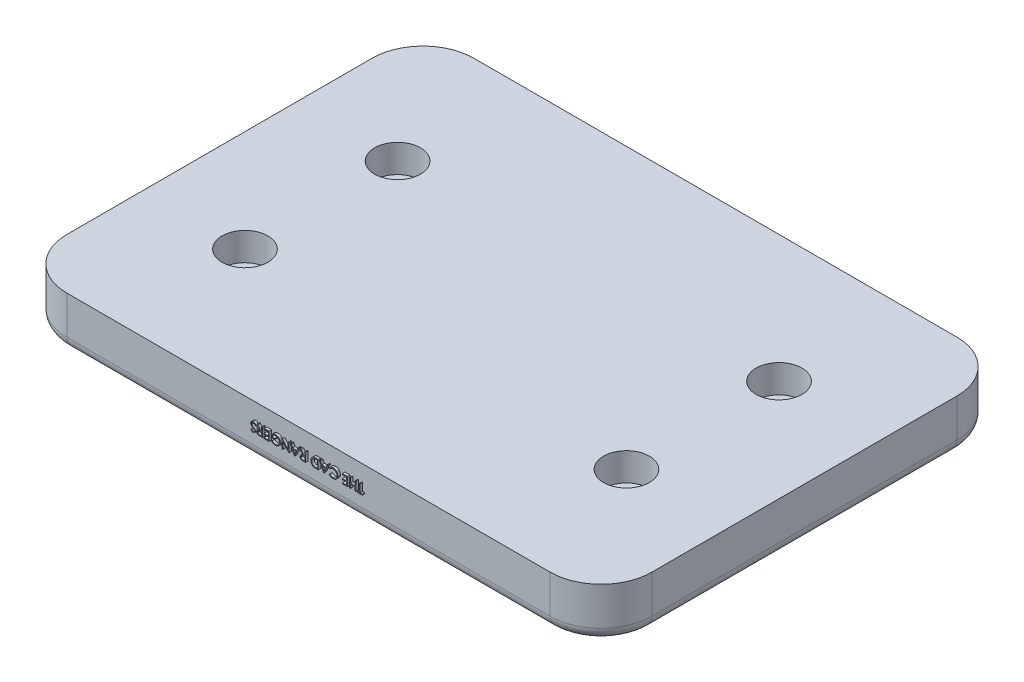
from build123d import *

# Parameters (mm, degrees)
BOSS_EXTRUDE1_DEPTH = 20
SKETCH2_R           = 5.5
CUT_EXTRUDE1_DEPTH  = 20
FILLET1_R           = 5
SKETCH3_R           = 9
CUT_EXTRUDE2_DEPTH  = 11
BOSS_EXTRUDE2_DEPTH = 1


with BuildPart() as part:
    # Sketch1 → Boss-Extrude1 (new body)
    with BuildSketch(Plane(origin=(0, 0, 0), x_dir=(1, 0, 0), z_dir=(0, 1, 0))):
        with BuildLine():
            Line((-95, -80), (95, -80))
            ThreePointArc((95, -80), (109.142135624, -74.142135624), (115, -60))
            Line((115, -60), (115, 60))
            ThreePointArc((115, 60), (109.142135624, 74.142135624), (95, 80))
            Line((95, 80), (-95, 80))
            ThreePointArc((-95, 80), (-109.142135624, 74.142135624), (-115, 60))
            Line((-115, 60), (-115, -60))
            ThreePointArc((-115, -60), (-109.142135624, -74.142135624), (-95, -80))
        make_face()
    extrude(amount=BOSS_EXTRUDE1_DEPTH)

    # Sketch2 → Cut-Extrude1 (cut)
    with BuildSketch(Plane.XZ):
        with Locations(Location((-75, 30, 0), (0, 0, 270))):
            Circle(SKETCH2_R)
        with Locations(Location((75, 30, 0), (0, 0, 90))):
            Circle(SKETCH2_R)
        with Locations(Location((75, -30, 0), (0, 0, 270))):
            Circle(SKETCH2_R)
        with Locations(Location((-75, -30, 0), (0, 0, 90))):
            Circle(SKETCH2_R)
    extrude(amount=-CUT_EXTRUDE1_DEPTH, mode=Mode.SUBTRACT)

    # Fillet1
    fillet1_edges = [part.edges().sort_by_distance(p)[0] for p in [
        (-115, 0, 0),
        (-109.142135624, 0, -74.142135624),
        (0, 0, -80),
        (109.142135624, 0, -74.142135624),
        (115, 0, 0),
        (109.142135624, 0, 74.142135624),
        (0, 0, 80),
        (-109.142135624, 0, 74.142135624),
    ]]
    fillet(fillet1_edges, radius=FILLET1_R)

    # Sketch3 → Cut-Extrude2 (cut)
    with BuildSketch(Plane(origin=(0, 20, 0), x_dir=(1, 0, 0), z_dir=(0, 1, 0))):
        with Locations(Location((-75, 30, 0), (0, 0, 270))):
            Circle(SKETCH3_R)
        with Locations(Location((-75, -30, 0), (0, 0, 270))):
            Circle(SKETCH3_R)
        with Locations(Location((75, 30, 0), (0, 0, 270))):
            Circle(SKETCH3_R)
        with Locations(Location((75, -30, 0), (0, 0, 270))):
            Circle(SKETCH3_R)
    extrude(amount=-CUT_EXTRUDE2_DEPTH, mode=Mode.SUBTRACT)

    # Sketch4 → Boss-Extrude2 (add)
    # profile 1 of 13: a face of its own
    with BuildSketch(Plane.XY.offset(80)):
        Polygon((22.076923077, 10.601076919), (22.076923077, 10.24210256), (20.237179487, 10.24210256), (20.237179487, 10.601076919), (21, 10.601076919), (21, 13.74210256), (21.314102564, 13.74210256), (21.314102564, 10.601076919), align=None)
    # profile 2 of 13: a face of its own
    with BuildSketch(Plane.XY.offset(80)):
        Polygon((19.608974359, 10.24210256), (19.294871795, 10.24210256), (19.294871795, 11.677999996), (17.5, 11.677999996), (17.5, 10.24210256), (17.185897436, 10.24210256), (17.185897436, 13.74210256), (17.5, 13.74210256), (17.5, 12.036974355), (19.294871795, 12.036974355), (19.294871795, 13.74210256), (19.608974359, 13.74210256), align=None)
    # profile 3 of 13: a face of its own
    with BuildSketch(Plane.XY.offset(80)):
        Polygon((16.288461538, 10.24210256), (14.314102564, 10.24210256), (14.314102564, 10.601076919), (15.974358974, 10.601076919), (15.974358974, 11.677999996), (14.314102564, 11.677999996), (14.314102564, 12.036974355), (15.974358974, 12.036974355), (15.974358974, 13.383128201), (14.314102564, 13.383128201), (14.314102564, 13.74210256), (16.288461538, 13.74210256), align=None)
    # profile 4 of 13: a face of its own
    with BuildSketch(Plane.XY.offset(80)):
        with BuildLine():
            Line((9.108974359, 10.884330124), (9.383814103, 11.094666662))
            add(Edge.make_bspline(
                [(9.383814103, 11.094666662), (9.403420192, 11.071301002), (9.442368038, 11.0248847), (9.505024287, 10.959700614), (9.570336979, 10.898652342), (9.638215242, 10.84134764), (9.710229934, 10.790089704), (9.783637093, 10.740886522), (9.861103927, 10.697807443), (9.96768179, 10.645180959), (10.107647448, 10.591462617), (10.28323229, 10.545260206), (10.466778108, 10.516126028), (10.591970922, 10.512949195), (10.655649038, 10.511333329)],
                knots=[0, 0, 0, 0, 0.75789156, 1.505565099, 2.245254514, 2.979266606, 3.711207489, 4.440978832, 5.174393176, 5.91211879, 7.394186119, 8.890401545, 10.418332761, 12, 12, 12, 12], degree=3))
            add(Edge.make_bspline(
                [(10.655649038, 10.511333329), (10.690731911, 10.511739114), (10.760572055, 10.512546919), (10.864226822, 10.523129144), (10.966142355, 10.53817388), (11.065939666, 10.55995426), (11.163420604, 10.588310337), (11.2593274, 10.621564451), (11.352530553, 10.662945805), (11.44415164, 10.708646044), (11.531927025, 10.760278697), (11.614994182, 10.816579569), (11.69297847, 10.876992479), (11.766078215, 10.94137466), (11.833556827, 11.010477731), (11.89613116, 11.083525276), (11.953721345, 11.160847184), (12.006267963, 11.242074007), (12.053267598, 11.326804508), (12.094023918, 11.414674733), (12.128474972, 11.505348995), (12.156423841, 11.598632967), (12.178297769, 11.694196446), (12.193439185, 11.792381603), (12.203923916, 11.893016814), (12.204724602, 11.961225918), (12.205128205, 11.995608169)],
                knots=[0, 0, 0, 0, 1.054960097, 2.100129169, 3.131228542, 4.15308236, 5.169990287, 6.183953224, 7.204064171, 8.235355279, 9.262684623, 10.264978336, 11.252191258, 12.228402777, 13.192898315, 14.155264692, 15.119862721, 16.091023151, 17.063429752, 18.032246104, 19.00241354, 19.978852882, 20.959535218, 21.948948728, 22.966123959, 24, 24, 24, 24], degree=3))
            add(Edge.make_bspline(
                [(12.205128205, 11.995608169), (12.203863427, 12.047338336), (12.201380204, 12.148903656), (12.179373871, 12.297690637), (12.145664481, 12.440365495), (12.095970439, 12.575962192), (12.033472298, 12.705611091), (11.955491851, 12.827739933), (11.864835006, 12.944137942), (11.760571741, 13.051986025), (11.6461629, 13.150498357), (11.52341579, 13.237249308), (11.39263129, 13.309564093), (11.255254717, 13.369740065), (11.110228588, 13.415996786), (10.95781379, 13.448560911), (10.798341793, 13.469803091), (10.689372394, 13.471836779), (10.633914263, 13.472871791)],
                knots=[0, 0, 0, 0, 1.029159485, 2.020618137, 2.987588728, 3.942669054, 4.889339625, 5.846988364, 6.821327795, 7.821533711, 8.827683044, 9.822769455, 10.807800696, 11.797391277, 12.803701919, 13.832062008, 14.896664671, 16, 16, 16, 16], degree=3))
            add(Edge.make_bspline(
                [(10.633914263, 13.472871791), (10.572811574, 13.471183011), (10.452546865, 13.467859088), (10.276178839, 13.439699839), (10.107343073, 13.394041921), (9.946030486, 13.330143999), (9.79269584, 13.247078711), (9.64709918, 13.146380834), (9.509117609, 13.027092501), (9.426146327, 12.936009373), (9.383814103, 12.889538457)],
                knots=[0, 0, 0, 0, 1.028121516, 2.023589091, 2.998037872, 3.967518031, 4.937445131, 5.927275754, 6.942489185, 8, 8, 8, 8], degree=3))
            Line((9.383814103, 12.889538457), (9.108974359, 13.09777163))
            add(Edge.make_bspline(
                [(9.108974359, 13.09777163), (9.131093215, 13.126309143), (9.175224979, 13.183247476), (9.246671929, 13.263533111), (9.32199057, 13.338985127), (9.401384231, 13.409210573), (9.484956553, 13.474560462), (9.572671011, 13.534730929), (9.664090115, 13.590389445), (9.759328337, 13.640837351), (9.858390888, 13.685727561), (9.960428826, 13.724961502), (10.065629064, 13.757905961), (10.173162013, 13.785586127), (10.284132572, 13.805355053), (10.397271045, 13.821088092), (10.513630821, 13.830424175), (10.592064146, 13.831367906), (10.631810897, 13.83184615)],
                knots=[0, 0, 0, 0, 0.986880684, 1.969034265, 2.935876267, 3.899990983, 4.864973347, 5.834408638, 6.8063673, 7.789580233, 8.778939794, 9.778051223, 10.776304221, 11.791326552, 12.811423977, 13.855999788, 14.91350973, 16, 16, 16, 16], degree=3))
            add(Edge.make_bspline(
                [(10.631810897, 13.83184615), (10.669454564, 13.831584157), (10.743890255, 13.831066099), (10.853789006, 13.822673932), (10.960778587, 13.811224195), (11.064553213, 13.793984064), (11.165679188, 13.773639724), (11.263239772, 13.746368467), (11.358194983, 13.715819301), (11.450163323, 13.679914314), (11.539223023, 13.639398131), (11.625086835, 13.593606572), (11.707715267, 13.542924708), (11.787920688, 13.488469697), (11.864518272, 13.428492395), (11.938171797, 13.363825761), (12.009294273, 13.29468775), (12.053296958, 13.244832897), (12.075420673, 13.219766823)],
                knots=[0, 0, 0, 0, 1.114604814, 2.203992996, 3.262667896, 4.300477797, 5.318619304, 6.316056647, 7.298880507, 8.271930387, 9.238335007, 10.195173496, 11.151986948, 12.108099108, 13.064862484, 14.031167946, 15.010108607, 16, 16, 16, 16], degree=3))
            add(Edge.make_bspline(
                [(12.075420673, 13.219766823), (12.110854005, 13.176224736), (12.181292887, 13.089666239), (12.271452601, 12.949393483), (12.348371514, 12.803067255), (12.411257532, 12.649840007), (12.459561329, 12.489652173), (12.493522039, 12.322761448), (12.515436834, 12.149501456), (12.517952196, 12.031666328), (12.519230769, 11.971770028)],
                knots=[0, 0, 0, 0, 0.994611881, 1.977215934, 2.950189954, 3.921972279, 4.908960509, 5.911694611, 6.938501887, 8, 8, 8, 8], degree=3))
            add(Edge.make_bspline(
                [(12.519230769, 11.971770028), (12.51766862, 11.908817208), (12.514595188, 11.784961466), (12.488698673, 11.603149919), (12.446534143, 11.429212252), (12.388473305, 11.262479193), (12.311875535, 11.103904725), (12.21914774, 10.952819122), (12.109384194, 10.80934575), (11.983963421, 10.675318928), (11.846388838, 10.55278284), (11.699071919, 10.444975783), (11.542289472, 10.355258492), (11.377771755, 10.280262269), (11.204286037, 10.222617823), (11.022202678, 10.182264631), (10.83186376, 10.157147516), (10.702001335, 10.153972308), (10.636017628, 10.15235897)],
                knots=[0, 0, 0, 0, 1.032901378, 2.032168977, 3.007206631, 3.966850309, 4.924221947, 5.891988639, 6.871730993, 7.884084801, 8.900290346, 9.89161143, 10.874607481, 11.860025555, 12.854717796, 13.869097222, 14.917278314, 16, 16, 16, 16], degree=3))
            add(Edge.make_bspline(
                [(10.636017628, 10.15235897), (10.595803209, 10.152841168), (10.516202817, 10.153795629), (10.398449394, 10.163100913), (10.283809901, 10.178617674), (10.171965427, 10.199764442), (10.062731491, 10.226066958), (9.956598999, 10.259001182), (9.85387205, 10.298820835), (9.753857953, 10.343139123), (9.657839059, 10.393895528), (9.565863128, 10.449065458), (9.478676987, 10.509711299), (9.395713886, 10.574948552), (9.317357386, 10.645279078), (9.24243152, 10.719520712), (9.173160999, 10.79964286), (9.130409071, 10.856049361), (9.108974359, 10.884330124)],
                knots=[0, 0, 0, 0, 1.096566765, 2.170543479, 3.218870886, 4.250164525, 5.273529809, 6.281496242, 7.278154839, 8.276706968, 9.263143576, 10.238168486, 11.199979644, 12.157579042, 13.114563119, 14.070017788, 15.032356758, 16, 16, 16, 16], degree=3))
        make_face()
    # profile 5 of 13: a face of its own
    with BuildSketch(Plane.XY.offset(80)):
        Polygon((6.955128205, 10.24210256), (5.33974359, 13.74210256), (5.681189904, 13.74210256), (6.198617788, 12.620307688), (7.78525641, 12.620307688), (8.317407853, 13.74210256), (8.66025641, 13.74210256), (7, 10.24210256), align=None)
        Polygon((6.981069712, 10.924294066), (7.614883814, 12.261333329), (6.364082532, 12.261333329), align=None, mode=Mode.SUBTRACT)
    # profile 6 of 13: a face of its own
    with BuildSketch(Plane.XY.offset(80)):
        with BuildLine():
            Line((4.801282051, 13.74210256), (4.801282051, 10.24210256))
            Line((4.801282051, 10.24210256), (4.094551282, 10.24210256))
            add(Edge.make_bspline(
                [(4.094551282, 10.24210256), (4.033082166, 10.242543924), (3.914324154, 10.243396637), (3.742713418, 10.248834182), (3.584156127, 10.258356082), (3.438742322, 10.272493394), (3.306238385, 10.289462131), (3.186856536, 10.311042127), (3.080403308, 10.336421664), (3.014933995, 10.358068133), (2.983974359, 10.368304483)],
                knots=[0, 0, 0, 0, 1.314317071, 2.539253741, 3.67075822, 4.709970291, 5.662644612, 6.526156501, 7.303037452, 8, 8, 8, 8], degree=3))
            add(Edge.make_bspline(
                [(2.983974359, 10.368304483), (2.943475998, 10.383730401), (2.863397645, 10.414232427), (2.749443094, 10.471858237), (2.641803791, 10.536883824), (2.541329662, 10.6108), (2.447799317, 10.692662203), (2.36003594, 10.781808103), (2.280555107, 10.880617595), (2.206615499, 10.986024656), (2.141899159, 11.098988513), (2.084831783, 11.217246515), (2.036104908, 11.340569206), (1.998084857, 11.469856415), (1.966673725, 11.60386639), (1.945597626, 11.74361375), (1.93159762, 11.888283757), (1.930197561, 11.986459484), (1.929487179, 12.036273233)],
                knots=[0, 0, 0, 0, 0.984696416, 1.947063185, 2.89840987, 3.841051395, 4.778753227, 5.721858861, 6.681155121, 7.65838316, 8.646299769, 9.637283673, 10.641736726, 11.657050558, 12.698485921, 13.768600492, 14.86780186, 16, 16, 16, 16], degree=3))
            add(Edge.make_bspline(
                [(1.929487179, 12.036273233), (1.930116571, 12.079534325), (1.931356854, 12.164784825), (1.942480096, 12.29042782), (1.958678611, 12.412333718), (1.983642318, 12.529967244), (2.014317142, 12.64412039), (2.052177697, 12.754252657), (2.097052068, 12.860438898), (2.149093592, 12.961835706), (2.206076938, 13.058196521), (2.268169649, 13.147994567), (2.333245708, 13.232219907), (2.403678559, 13.308969797), (2.47713624, 13.38063425), (2.55611715, 13.444034227), (2.638148303, 13.502113056), (2.725694153, 13.553106985), (2.819472981, 13.598467599), (2.921934423, 13.636774911), (3.032704524, 13.669741206), (3.152517268, 13.696006493), (3.280973069, 13.717177648), (3.418420142, 13.73127655), (3.564601107, 13.740837365), (3.664980702, 13.741672639), (3.716646635, 13.74210256)],
                knots=[0, 0, 0, 0, 1.105894396, 2.179280415, 3.222964075, 4.248423888, 5.251546139, 6.243661943, 7.223682738, 8.196462441, 9.155694589, 10.083899862, 10.986397372, 11.874737962, 12.745335529, 13.607670254, 14.461432187, 15.313100333, 16.195087267, 17.121790994, 18.106827133, 19.14775296, 20.255889161, 21.433815148, 22.679170477, 24, 24, 24, 24], degree=3))
            Line((3.716646635, 13.74210256), (4.801282051, 13.74210256))
        make_face()
        with BuildLine():
            Line((4.487179487, 13.383128201), (4.085436699, 13.383128201))
            add(Edge.make_bspline(
                [(4.085436699, 13.383128201), (4.027708328, 13.382880105), (3.91667553, 13.382402924), (3.757017532, 13.378215721), (3.611138136, 13.371373784), (3.479016626, 13.361798706), (3.360727602, 13.349130091), (3.256023852, 13.335005188), (3.165248594, 13.317407737), (3.110319157, 13.301456778), (3.084935897, 13.294085733)],
                knots=[0, 0, 0, 0, 1.375205317, 2.645023457, 3.804390687, 4.853969522, 5.800190428, 6.637939096, 7.370582563, 8, 8, 8, 8], degree=3))
            add(Edge.make_bspline(
                [(3.084935897, 13.294085733), (3.052986856, 13.282835015), (2.989851877, 13.260602303), (2.898980608, 13.220032486), (2.814187386, 13.172035265), (2.734058618, 13.118367666), (2.659109265, 13.058201011), (2.589686413, 12.991343955), (2.525241707, 12.918570516), (2.466806967, 12.839635483), (2.41395738, 12.755414679), (2.368295512, 12.666001919), (2.329803073, 12.571898955), (2.298222587, 12.473433188), (2.273600636, 12.370546014), (2.256265814, 12.262979238), (2.245523628, 12.150775339), (2.2442414, 12.074391884), (2.243589744, 12.035572111)],
                knots=[0, 0, 0, 0, 0.998420628, 1.972994, 2.929372424, 3.86770908, 4.81360496, 5.759023883, 6.706048443, 7.676227424, 8.651287839, 9.634325482, 10.632389399, 11.645655052, 12.680158286, 13.74837235, 14.855672678, 16, 16, 16, 16], degree=3))
            add(Edge.make_bspline(
                [(2.243589744, 12.035572111), (2.244103578, 11.994638876), (2.24511301, 11.914225173), (2.257779565, 11.796231003), (2.276329222, 11.682762942), (2.303011456, 11.573739297), (2.337482602, 11.46930191), (2.378730123, 11.368860756), (2.428811087, 11.273708415), (2.485508033, 11.183038984), (2.549160739, 11.098225595), (2.619486844, 11.020261881), (2.695744801, 10.949002614), (2.777583162, 10.884334338), (2.866146164, 10.82740709), (2.959935148, 10.776765498), (3.060271257, 10.73373739), (3.130085267, 10.710860206), (3.165564904, 10.69923397)],
                knots=[0, 0, 0, 0, 1.122272916, 2.204715076, 3.251197285, 4.274229216, 5.279697671, 6.265416158, 7.248880903, 8.225321784, 9.195852973, 10.153576302, 11.101466393, 12.055578741, 13.010401466, 13.985536859, 14.976245305, 16, 16, 16, 16], degree=3))
            add(Edge.make_bspline(
                [(3.165564904, 10.69923397), (3.19491605, 10.691117542), (3.25732464, 10.67385979), (3.359164105, 10.655034417), (3.473779254, 10.638429918), (3.601678955, 10.624371879), (3.742717414, 10.614284557), (3.897003102, 10.606713243), (4.064602707, 10.60160661), (4.180785241, 10.601257903), (4.241085737, 10.601076919)],
                knots=[0, 0, 0, 0, 0.674548936, 1.434276114, 2.292660221, 3.240891867, 4.284742987, 5.42552168, 6.663806718, 8, 8, 8, 8], degree=3))
            Line((4.241085737, 10.601076919), (4.487179487, 10.601076919))
            Line((4.487179487, 10.601076919), (4.487179487, 13.383128201))
        make_face(mode=Mode.SUBTRACT)
    # profile 7 of 13: a face of its own
    with BuildSketch(Plane.XY.offset(80)):
        with BuildLine():
            Line((-0.134615385, 10.24210256), (-0.835036058, 10.24210256))
            add(Edge.make_bspline(
                [(-0.835036058, 10.24210256), (-0.881777186, 10.242258146), (-0.971525331, 10.242556888), (-1.100098601, 10.244222651), (-1.216925698, 10.248997007), (-1.321945537, 10.25310559), (-1.415156192, 10.260597532), (-1.496843483, 10.267758179), (-1.566631181, 10.277131839), (-1.608877032, 10.285837262), (-1.628004808, 10.289778842)],
                knots=[0, 0, 0, 0, 1.410062039, 2.707475311, 3.878576406, 4.937260626, 5.877586885, 6.699081471, 7.410979367, 8, 8, 8, 8], degree=3))
            add(Edge.make_bspline(
                [(-1.628004808, 10.289778842), (-1.653611863, 10.296104907), (-1.704279706, 10.308622084), (-1.777223517, 10.335091849), (-1.846760917, 10.365673976), (-1.91263726, 10.401868175), (-1.974835282, 10.443063258), (-2.033348718, 10.489424833), (-2.087393016, 10.541350123), (-2.138890991, 10.596688178), (-2.18385856, 10.657848349), (-2.224341301, 10.72172692), (-2.258325175, 10.789553713), (-2.285066691, 10.860986624), (-2.307484887, 10.935324933), (-2.322552008, 11.013303202), (-2.331936074, 11.094667731), (-2.332863221, 11.150029018), (-2.333333333, 11.178100156)],
                knots=[0, 0, 0, 0, 1.027276577, 2.032638556, 3.019345632, 3.985365262, 4.957888996, 5.923693931, 6.890056973, 7.876427719, 8.865527834, 9.843495157, 10.821038291, 11.815616373, 12.812734995, 13.843357168, 14.906466538, 16, 16, 16, 16], degree=3))
            add(Edge.make_bspline(
                [(-2.333333333, 11.178100156), (-2.331864373, 11.224735314), (-2.328998052, 11.315732587), (-2.302272416, 11.447792719), (-2.258497843, 11.570984774), (-2.19816738, 11.685137314), (-2.121374456, 11.788085334), (-2.029086824, 11.878202106), (-1.92177579, 11.954309825), (-1.821407236, 12.006526429), (-1.732704852, 12.04012483), (-1.659465182, 12.063883462), (-1.579512418, 12.081930439), (-1.493993603, 12.098332619), (-1.402248183, 12.110848801), (-1.304460909, 12.119737668), (-1.20038721, 12.125453277), (-1.129047448, 12.126288352), (-1.092347756, 12.126717944)],
                knots=[0, 0, 0, 0, 1.260402266, 2.459371274, 3.627181936, 4.786749125, 5.93865593, 7.087644312, 8.261344208, 9.485713728, 10.136162886, 10.825977872, 11.566646758, 12.35154167, 13.181268117, 14.0701832, 15.007234106, 16, 16, 16, 16], degree=3))
            Line((-1.092347756, 12.126717944), (-2.378205128, 13.74210256))
            Line((-2.378205128, 13.74210256), (-1.989783654, 13.74210256))
            Line((-1.989783654, 13.74210256), (-0.703926282, 12.126717944))
            Line((-0.703926282, 12.126717944), (-0.448717949, 12.126717944))
            Line((-0.448717949, 12.126717944), (-0.448717949, 13.74210256))
            Line((-0.448717949, 13.74210256), (-0.134615385, 13.74210256))
            Line((-0.134615385, 13.74210256), (-0.134615385, 10.24210256))
        make_face()
        with BuildLine():
            Line((-0.448717949, 10.601076919), (-0.448717949, 11.767743585))
            Line((-0.448717949, 11.767743585), (-1.089543269, 11.772651438))
            add(Edge.make_bspline(
                [(-1.089543269, 11.772651438), (-1.119463312, 11.772664682), (-1.177456876, 11.772690353), (-1.26135749, 11.768696474), (-1.339477776, 11.764153506), (-1.411517948, 11.757202992), (-1.477513429, 11.748250759), (-1.537420627, 11.737035255), (-1.59137193, 11.724023989), (-1.654094572, 11.703679871), (-1.724939899, 11.672838071), (-1.800345219, 11.625015179), (-1.866285012, 11.567180441), (-1.92110667, 11.500210917), (-1.965139488, 11.426262722), (-1.995724202, 11.347009414), (-2.01587935, 11.263699706), (-2.01810075, 11.20649759), (-2.019230769, 11.177399034)],
                knots=[0, 0, 0, 0, 1.146399208, 2.222048177, 3.218135709, 4.144938032, 4.994811973, 5.769438708, 6.479732432, 7.119818093, 8.294689872, 9.430121864, 10.527913442, 11.641375077, 12.733452768, 13.811150417, 14.886538365, 16, 16, 16, 16], degree=3))
            add(Edge.make_bspline(
                [(-2.019230769, 11.177399034), (-2.018043533, 11.149246956), (-2.015690863, 11.093459809), (-1.996045115, 11.011972676), (-1.963966721, 10.934489107), (-1.920059633, 10.862075327), (-1.865412553, 10.796829489), (-1.801761013, 10.741174696), (-1.730602874, 10.69493828), (-1.664634649, 10.66443138), (-1.605240014, 10.646481073), (-1.553908472, 10.633450964), (-1.495402533, 10.624325267), (-1.430410804, 10.615932063), (-1.35864778, 10.608824305), (-1.280069731, 10.604106526), (-1.194732838, 10.601286702), (-1.135585923, 10.601148474), (-1.104967949, 10.601076919)],
                knots=[0, 0, 0, 0, 1.100596872, 2.180981401, 3.259506136, 4.371595435, 5.481727359, 6.576991111, 7.667816242, 8.793363246, 9.406619729, 10.09427138, 10.864108636, 11.721733836, 12.6590937, 13.685439239, 14.801845161, 16, 16, 16, 16], degree=3))
            Line((-1.104967949, 10.601076919), (-0.448717949, 10.601076919))
        make_face(mode=Mode.SUBTRACT)
    # profile 8 of 13: a face of its own
    with BuildSketch(Plane.XY.offset(80)):
        Polygon((-4.532051282, 10.24210256), (-6.147435897, 13.74210256), (-5.805989583, 13.74210256), (-5.288561699, 12.620307688), (-3.701923077, 12.620307688), (-3.169771635, 13.74210256), (-2.826923077, 13.74210256), (-4.487179487, 10.24210256), align=None)
        Polygon((-4.506109776, 10.924294066), (-3.872295673, 12.261333329), (-5.123096955, 12.261333329), align=None, mode=Mode.SUBTRACT)
    # profile 9 of 13: a face of its own
    with BuildSketch(Plane.XY.offset(80)):
        Polygon((-6.685897436, 13.74210256), (-6.685897436, 10.24210256), (-6.751802885, 10.24210256), (-9.064102564, 12.996810092), (-9.064102564, 10.24210256), (-9.378205128, 10.24210256), (-9.378205128, 13.74210256), (-9.306690705, 13.74210256), (-7, 10.993705124), (-7, 13.74210256), align=None)
    # profile 10 of 13: a face of its own
    with BuildSketch(Plane.XY.offset(80)):
        with BuildLine():
            Line((-13.551282051, 10.839458329), (-13.282051282, 11.094666662))
            add(Edge.make_bspline(
                [(-13.282051282, 11.094666662), (-13.233047118, 11.048898734), (-13.136467475, 10.95869721), (-12.979762604, 10.840356876), (-12.816039242, 10.739770971), (-12.646628468, 10.657131984), (-12.47479716, 10.592893792), (-12.303975933, 10.546446192), (-12.135362408, 10.516574713), (-12.023421745, 10.513065879), (-11.968149038, 10.511333329)],
                knots=[0, 0, 0, 0, 1.091957225, 2.152079168, 3.193085318, 4.218301889, 5.218403563, 6.17723952, 7.099979378, 8, 8, 8, 8], degree=3))
            add(Edge.make_bspline(
                [(-11.968149038, 10.511333329), (-11.934234529, 10.511747546), (-11.866493468, 10.512574905), (-11.765868691, 10.523110029), (-11.66631269, 10.53830902), (-11.568168779, 10.560074119), (-11.471046752, 10.588343302), (-11.375162666, 10.622474124), (-11.280701579, 10.663560354), (-11.188160427, 10.710402417), (-11.097987511, 10.761538235), (-11.013179404, 10.818569814), (-10.933382446, 10.879742123), (-10.859160923, 10.945857423), (-10.789498166, 11.015815303), (-10.725669387, 11.090609781), (-10.666278742, 11.16913383), (-10.613547645, 11.252513035), (-10.565886515, 11.338378314), (-10.524616037, 11.42604521), (-10.489079765, 11.514895426), (-10.460684114, 11.604979047), (-10.437855097, 11.696238553), (-10.421696422, 11.788531357), (-10.412620533, 11.882312185), (-10.411047298, 11.945109022), (-10.41025641, 11.97667788)],
                knots=[0, 0, 0, 0, 1.028307134, 2.053947307, 3.065600992, 4.082111276, 5.100671203, 6.132125737, 7.167228006, 8.222953114, 9.277225349, 10.309459149, 11.320441984, 12.324791754, 13.322338422, 14.312705492, 15.305176196, 16.306142747, 17.302479595, 18.282363326, 19.243345101, 20.20291386, 21.145121196, 22.094978082, 23.042318507, 24, 24, 24, 24], degree=3))
            add(Edge.make_bspline(
                [(-10.41025641, 11.97667788), (-10.411019354, 12.008946732), (-10.412543159, 12.073396319), (-10.422095574, 12.169619746), (-10.440421538, 12.264217921), (-10.46280648, 12.358083276), (-10.494491755, 12.450017746), (-10.531324901, 12.541367676), (-10.575737417, 12.631284081), (-10.626879421, 12.719140204), (-10.683396825, 12.80463784), (-10.745545887, 12.885850986), (-10.813443985, 12.961830528), (-10.885842778, 13.033687318), (-10.963402815, 13.100967583), (-11.046876335, 13.162860438), (-11.135094931, 13.220322917), (-11.228097719, 13.272723753), (-11.324901699, 13.31953112), (-11.424158131, 13.36115533), (-11.526186032, 13.395434584), (-11.630448699, 13.42337271), (-11.736821977, 13.446273001), (-11.845845778, 13.461005483), (-11.956718487, 13.471696314), (-12.031457119, 13.472477984), (-12.069110577, 13.472871791)],
                knots=[0, 0, 0, 0, 0.935896426, 1.86923723, 2.799743935, 3.728471844, 4.66505513, 5.616527375, 6.583419551, 7.570341864, 8.562833498, 9.553750335, 10.533080376, 11.5155245, 12.510142773, 13.507781369, 14.526649666, 15.561487327, 16.601173999, 17.643331812, 18.680652164, 19.71969803, 20.772446191, 21.833473655, 22.9085001, 24, 24, 24, 24], degree=3))
            add(Edge.make_bspline(
                [(-12.069110577, 13.472871791), (-12.114489109, 13.471923608), (-12.20359723, 13.470061697), (-12.334581047, 13.455555824), (-12.460393675, 13.43292936), (-12.580625478, 13.399690287), (-12.695712999, 13.357617917), (-12.805231022, 13.305589047), (-12.909484744, 13.244152839), (-13.008012545, 13.174546919), (-13.098510196, 13.097013184), (-13.180767455, 13.014025599), (-13.2523739, 12.924922001), (-13.313796519, 12.829721782), (-13.366663709, 12.729826732), (-13.408835171, 12.623524667), (-13.441452764, 12.512002925), (-13.454796224, 12.434905041), (-13.461538462, 12.395948714)],
                knots=[0, 0, 0, 0, 1.130234505, 2.219399076, 3.279128566, 4.311639422, 5.322903917, 6.328167287, 7.327698761, 8.334124803, 9.329374007, 10.292761544, 11.24113083, 12.171311216, 13.111441694, 14.052040787, 15.015727358, 16, 16, 16, 16], degree=3))
            Line((-13.461538462, 12.395948714), (-12.294871795, 12.395948714))
            Line((-12.294871795, 12.395948714), (-12.294871795, 12.036974355))
            Line((-12.294871795, 12.036974355), (-13.775641026, 12.036974355))
            add(Edge.make_bspline(
                [(-13.775641026, 12.036974355), (-13.773935177, 12.103881844), (-13.770596524, 12.234831885), (-13.747177608, 12.425802156), (-13.709361096, 12.606173849), (-13.657700784, 12.776136921), (-13.590825504, 12.935450514), (-13.509452975, 13.08427638), (-13.412280854, 13.221653061), (-13.302770413, 13.348702064), (-13.179870455, 13.462031277), (-13.046901835, 13.561637215), (-12.903644867, 13.64553983), (-12.750235059, 13.713800492), (-12.587174626, 13.767074487), (-12.414086246, 13.804846064), (-12.231204645, 13.827476027), (-12.105867968, 13.830367407), (-12.041766827, 13.83184615)],
                knots=[0, 0, 0, 0, 1.140356446, 2.231883559, 3.274166699, 4.278491846, 5.25512956, 6.21435461, 7.1637429, 8.11826594, 9.068280886, 10.0076534, 10.945064095, 11.891975133, 12.864533718, 13.863980011, 14.907571808, 16, 16, 16, 16], degree=3))
            add(Edge.make_bspline(
                [(-12.041766827, 13.83184615), (-12.002256692, 13.831277028), (-11.924329971, 13.830154538), (-11.809239043, 13.82217719), (-11.697321422, 13.809896614), (-11.588593413, 13.791351491), (-11.482655071, 13.768636837), (-11.380035486, 13.739550118), (-11.280343744, 13.705881418), (-11.183425758, 13.667585745), (-11.090161212, 13.623214088), (-11.000134695, 13.573904449), (-10.912848569, 13.519911088), (-10.828897404, 13.460300242), (-10.747843782, 13.395517782), (-10.670210339, 13.325433863), (-10.595562461, 13.250262743), (-10.548801997, 13.196883734), (-10.525240385, 13.169987175)],
                knots=[0, 0, 0, 0, 1.107784379, 2.184907829, 3.233506516, 4.263428166, 5.276301166, 6.270063455, 7.25232949, 8.225834625, 9.190232166, 10.146266622, 11.1027726, 12.066435141, 13.031522626, 14.010570082, 14.99756817, 16, 16, 16, 16], degree=3))
            add(Edge.make_bspline(
                [(-10.525240385, 13.169987175), (-10.491054453, 13.127316522), (-10.42325004, 13.042683505), (-10.335971883, 12.907083561), (-10.261570481, 12.7666817), (-10.201202658, 12.621087072), (-10.154064572, 12.470435859), (-10.120258319, 12.314920568), (-10.10045103, 12.154340938), (-10.097597493, 12.045675673), (-10.096153846, 11.990700316)],
                knots=[0, 0, 0, 0, 1.023165419, 2.029347347, 3.013907458, 3.994755782, 4.975994455, 5.96558838, 6.970761222, 8, 8, 8, 8], degree=3))
            add(Edge.make_bspline(
                [(-10.096153846, 11.990700316), (-10.096687526, 11.949534496), (-10.097748104, 11.867726049), (-10.110552406, 11.746262375), (-10.129033182, 11.626985499), (-10.155801875, 11.509784983), (-10.191022765, 11.395181145), (-10.2333217, 11.282293376), (-10.282865784, 11.171572882), (-10.340681913, 11.064001009), (-10.4036141, 10.959614543), (-10.474380352, 10.86169907), (-10.549049478, 10.768361313), (-10.631198789, 10.682243842), (-10.717749964, 10.600595552), (-10.810855836, 10.525568441), (-10.90898887, 10.455896664), (-11.012941452, 10.39294358), (-11.121064692, 10.336375421), (-11.233125882, 10.286787423), (-11.349083672, 10.24580378), (-11.468071237, 10.211030089), (-11.590988714, 10.185314924), (-11.716944257, 10.166666186), (-11.846594368, 10.153905584), (-11.934230397, 10.152879329), (-11.978665865, 10.15235897)],
                knots=[0, 0, 0, 0, 1.009025537, 2.005226976, 2.991671811, 3.967589759, 4.950148279, 5.929425679, 6.922109907, 7.921964004, 8.922507644, 9.908469609, 10.882248289, 11.851158214, 12.824245259, 13.798023939, 14.780666017, 15.773333703, 16.775582742, 17.771174102, 18.775387309, 19.789283316, 20.80873549, 21.851817535, 22.910773411, 24, 24, 24, 24], degree=3))
            add(Edge.make_bspline(
                [(-11.978665865, 10.15235897), (-12.014904374, 10.152937014), (-12.086761078, 10.154083206), (-12.193682932, 10.162069049), (-12.298741613, 10.174586255), (-12.40246414, 10.192089472), (-12.504455578, 10.21524339), (-12.605024931, 10.243461316), (-12.703981987, 10.276132222), (-12.801209022, 10.315126688), (-12.897367069, 10.35937878), (-12.992988818, 10.409192624), (-13.08774809, 10.465417512), (-13.181809064, 10.52822108), (-13.275764924, 10.596524489), (-13.368129566, 10.672281315), (-13.46113251, 10.75250407), (-13.520934324, 10.810186254), (-13.551282051, 10.839458329)],
                knots=[0, 0, 0, 0, 0.985875312, 1.954874891, 2.915472732, 3.863573565, 4.815313299, 5.759461513, 6.704487138, 7.649063459, 8.607849844, 9.583336382, 10.581114205, 11.603942397, 12.659508253, 13.739925933, 14.853076422, 16, 16, 16, 16], degree=3))
        make_face()
    # profile 11 of 13: a face of its own
    with BuildSketch(Plane.XY.offset(80)):
        Polygon((-14.493589744, 10.24210256), (-16.467948718, 10.24210256), (-16.467948718, 10.601076919), (-14.807692308, 10.601076919), (-14.807692308, 11.677999996), (-16.467948718, 11.677999996), (-16.467948718, 12.036974355), (-14.807692308, 12.036974355), (-14.807692308, 13.383128201), (-16.467948718, 13.383128201), (-16.467948718, 13.74210256), (-14.493589744, 13.74210256), align=None)
    # profile 12 of 13: a face of its own
    with BuildSketch(Plane.XY.offset(80)):
        with BuildLine():
            Line((-17.096153846, 10.24210256), (-17.796574519, 10.24210256))
            add(Edge.make_bspline(
                [(-17.796574519, 10.24210256), (-17.843315648, 10.242258146), (-17.933063792, 10.242556888), (-18.061637063, 10.244222651), (-18.17846416, 10.248997007), (-18.283483999, 10.25310559), (-18.376694654, 10.260597532), (-18.458381945, 10.267758179), (-18.528169642, 10.277131839), (-18.570415493, 10.285837262), (-18.589543269, 10.289778842)],
                knots=[0, 0, 0, 0, 1.410062039, 2.707475311, 3.878576406, 4.937260626, 5.877586885, 6.699081471, 7.410979367, 8, 8, 8, 8], degree=3))
            add(Edge.make_bspline(
                [(-18.589543269, 10.289778842), (-18.615150325, 10.296104907), (-18.665818167, 10.308622084), (-18.738761978, 10.335091849), (-18.808299379, 10.365673976), (-18.874175721, 10.401868175), (-18.936373744, 10.443063258), (-18.994887179, 10.489424833), (-19.048931478, 10.541350123), (-19.100429453, 10.596688178), (-19.145397021, 10.657848349), (-19.185879762, 10.72172692), (-19.219863636, 10.789553713), (-19.246605153, 10.860986624), (-19.269023349, 10.935324933), (-19.284090469, 11.013303202), (-19.293474536, 11.094667731), (-19.294401682, 11.150029018), (-19.294871795, 11.178100156)],
                knots=[0, 0, 0, 0, 1.027276577, 2.032638556, 3.019345632, 3.985365262, 4.957888996, 5.923693931, 6.890056973, 7.876427719, 8.865527834, 9.843495157, 10.821038291, 11.815616373, 12.812734995, 13.843357168, 14.906466538, 16, 16, 16, 16], degree=3))
            add(Edge.make_bspline(
                [(-19.294871795, 11.178100156), (-19.293402835, 11.224735314), (-19.290536513, 11.315732587), (-19.263810877, 11.447792719), (-19.220036305, 11.570984774), (-19.159705841, 11.685137314), (-19.082912918, 11.788085334), (-18.990625285, 11.878202106), (-18.883314252, 11.954309825), (-18.782945697, 12.006526429), (-18.694243313, 12.04012483), (-18.621003643, 12.063883462), (-18.541050879, 12.081930439), (-18.455532065, 12.098332619), (-18.363786644, 12.110848801), (-18.265999371, 12.119737668), (-18.161925672, 12.125453277), (-18.09058591, 12.126288352), (-18.053886218, 12.126717944)],
                knots=[0, 0, 0, 0, 1.260402266, 2.459371274, 3.627181936, 4.786749125, 5.93865593, 7.087644312, 8.261344208, 9.485713728, 10.136162886, 10.825977872, 11.566646758, 12.35154167, 13.181268117, 14.0701832, 15.007234106, 16, 16, 16, 16], degree=3))
            Line((-18.053886218, 12.126717944), (-19.33974359, 13.74210256))
            Line((-19.33974359, 13.74210256), (-18.951322115, 13.74210256))
            Line((-18.951322115, 13.74210256), (-17.665464744, 12.126717944))
            Line((-17.665464744, 12.126717944), (-17.41025641, 12.126717944))
            Line((-17.41025641, 12.126717944), (-17.41025641, 13.74210256))
            Line((-17.41025641, 13.74210256), (-17.096153846, 13.74210256))
            Line((-17.096153846, 13.74210256), (-17.096153846, 10.24210256))
        make_face()
        with BuildLine():
            Line((-17.41025641, 10.601076919), (-17.41025641, 11.767743585))
            Line((-17.41025641, 11.767743585), (-18.051081731, 11.772651438))
            add(Edge.make_bspline(
                [(-18.051081731, 11.772651438), (-18.081001773, 11.772664682), (-18.138995338, 11.772690353), (-18.222895952, 11.768696474), (-18.301016237, 11.764153506), (-18.373056409, 11.757202992), (-18.43905189, 11.748250759), (-18.498959089, 11.737035255), (-18.552910392, 11.724023989), (-18.615633033, 11.703679871), (-18.68647836, 11.672838071), (-18.761883681, 11.625015179), (-18.827823474, 11.567180441), (-18.882645131, 11.500210917), (-18.926677949, 11.426262722), (-18.957262663, 11.347009414), (-18.977417812, 11.263699706), (-18.979639211, 11.20649759), (-18.980769231, 11.177399034)],
                knots=[0, 0, 0, 0, 1.146399208, 2.222048177, 3.218135709, 4.144938032, 4.994811973, 5.769438708, 6.479732432, 7.119818093, 8.294689872, 9.430121864, 10.527913442, 11.641375077, 12.733452768, 13.811150417, 14.886538365, 16, 16, 16, 16], degree=3))
            add(Edge.make_bspline(
                [(-18.980769231, 11.177399034), (-18.979581994, 11.149246956), (-18.977229324, 11.093459809), (-18.957583577, 11.011972676), (-18.925505183, 10.934489107), (-18.881598095, 10.862075327), (-18.826951015, 10.796829489), (-18.763299474, 10.741174696), (-18.692141335, 10.69493828), (-18.62617311, 10.66443138), (-18.566778475, 10.646481073), (-18.515446934, 10.633450964), (-18.456940995, 10.624325267), (-18.391949266, 10.615932063), (-18.320186242, 10.608824305), (-18.241608192, 10.604106526), (-18.1562713, 10.601286702), (-18.097124385, 10.601148474), (-18.06650641, 10.601076919)],
                knots=[0, 0, 0, 0, 1.100596872, 2.180981401, 3.259506136, 4.371595435, 5.481727359, 6.576991111, 7.667816242, 8.793363246, 9.406619729, 10.09427138, 10.864108636, 11.721733836, 12.6590937, 13.685439239, 14.801845161, 16, 16, 16, 16], degree=3))
            Line((-18.06650641, 10.601076919), (-17.41025641, 10.601076919))
        make_face(mode=Mode.SUBTRACT)
    # profile 13 of 13: a face of its own
    with BuildSketch(Plane.XY.offset(80)):
        with BuildLine():
            Line((-19.698717949, 13.066922271), (-19.994591346, 12.889538457))
            add(Edge.make_bspline(
                [(-19.994591346, 12.889538457), (-20.022109583, 12.935602842), (-20.074833464, 13.023860426), (-20.162784823, 13.143118467), (-20.253917734, 13.244480623), (-20.348907068, 13.327357231), (-20.447173016, 13.392606118), (-20.54935707, 13.438808349), (-20.65511488, 13.467624325), (-20.727088702, 13.471124411), (-20.763020833, 13.472871791)],
                knots=[0, 0, 0, 0, 1.272034388, 2.437168799, 3.508375237, 4.49857839, 5.41946034, 6.295179144, 7.148887113, 8, 8, 8, 8], degree=3))
            add(Edge.make_bspline(
                [(-20.763020833, 13.472871791), (-20.793701485, 13.471996786), (-20.854525948, 13.470262088), (-20.9442448, 13.454267271), (-21.030943986, 13.428099868), (-21.113760609, 13.392626819), (-21.190504405, 13.349023801), (-21.258870009, 13.297603912), (-21.3166342, 13.238203346), (-21.364389518, 13.172963841), (-21.401773172, 13.103247213), (-21.428372532, 13.030770396), (-21.445459384, 12.95599523), (-21.447625753, 12.905287542), (-21.448717949, 12.879722752)],
                knots=[0, 0, 0, 0, 1.095645842, 2.172120455, 3.244862764, 4.326153987, 5.384857088, 6.392105572, 7.372507978, 8.334705661, 9.272564127, 10.189475455, 11.087205874, 12, 12, 12, 12], degree=3))
            add(Edge.make_bspline(
                [(-21.448717949, 12.879722752), (-21.447275303, 12.850572176), (-21.444353788, 12.791539081), (-21.418606284, 12.704293664), (-21.379290923, 12.617581402), (-21.342338901, 12.563934179), (-21.323217147, 12.536173073)],
                knots=[0, 0, 0, 0, 0.938992559, 1.901562324, 2.914110574, 4, 4, 4, 4], degree=3))
            add(Edge.make_bspline(
                [(-21.323217147, 12.536173073), (-21.3075932, 12.516082728), (-21.274696394, 12.473781757), (-21.217309126, 12.411921045), (-21.152056187, 12.346421968), (-21.077248154, 12.278591877), (-20.993975888, 12.207043254), (-20.901295318, 12.133103054), (-20.800288633, 12.055668489), (-20.729045676, 12.004525185), (-20.692207532, 11.978080124)],
                knots=[0, 0, 0, 0, 0.722283655, 1.520795216, 2.39349503, 3.346893347, 4.386874146, 5.510198126, 6.712579003, 8, 8, 8, 8], degree=3))
            add(Edge.make_bspline(
                [(-20.692207532, 11.978080124), (-20.655388448, 11.951845533), (-20.584993162, 11.901686993), (-20.486471078, 11.827340321), (-20.398488769, 11.758933168), (-20.320597919, 11.697418421), (-20.254813665, 11.640113118), (-20.198731118, 11.590088502), (-20.154419375, 11.544673318), (-20.129760935, 11.515235348), (-20.118689904, 11.502018425)],
                knots=[0, 0, 0, 0, 1.452255772, 2.776602448, 3.96446981, 5.032613149, 5.964194703, 6.766668629, 7.446264616, 8, 8, 8, 8], degree=3))
            add(Edge.make_bspline(
                [(-20.118689904, 11.502018425), (-20.103219952, 11.481416366), (-20.072796215, 11.440899651), (-20.032593255, 11.377589366), (-19.998689989, 11.31290428), (-19.971404198, 11.24660996), (-19.949339213, 11.179204647), (-19.933998388, 11.11018229), (-19.924542628, 11.040011451), (-19.923565875, 10.992799585), (-19.923076923, 10.969165861)],
                knots=[0, 0, 0, 0, 1.068019517, 2.100403715, 3.106014851, 4.09224787, 5.069873182, 6.043214339, 7.020455327, 8, 8, 8, 8], degree=3))
            add(Edge.make_bspline(
                [(-19.923076923, 10.969165861), (-19.924376381, 10.932132914), (-19.926947521, 10.858858572), (-19.948871484, 10.751873774), (-19.983066964, 10.649415232), (-20.032539985, 10.553763303), (-20.093648422, 10.465053579), (-20.166184253, 10.384859695), (-20.251505869, 10.315942024), (-20.346490617, 10.257356495), (-20.449244537, 10.210618309), (-20.557232881, 10.176561939), (-20.669970407, 10.156602827), (-20.746583047, 10.153787489), (-20.785456731, 10.15235897)],
                knots=[0, 0, 0, 0, 1.005367131, 1.989245246, 2.955191616, 3.932180104, 4.904534562, 5.875498653, 6.859376768, 7.874484044, 8.900379497, 9.918679785, 10.943926428, 12, 12, 12, 12], degree=3))
            add(Edge.make_bspline(
                [(-20.785456731, 10.15235897), (-20.826713577, 10.153735671), (-20.908530837, 10.156465832), (-21.028915361, 10.181663836), (-21.145513202, 10.220814957), (-21.23895722, 10.267443186), (-21.312117834, 10.313511803), (-21.367851998, 10.355579361), (-21.42463846, 10.403904774), (-21.481865369, 10.4595118), (-21.54009814, 10.521286771), (-21.599068402, 10.589753055), (-21.659328055, 10.66429353), (-21.698081737, 10.717520308), (-21.717948718, 10.744806887)],
                knots=[0, 0, 0, 0, 1.286534051, 2.551350862, 3.822568981, 5.117864672, 5.799956111, 6.519305446, 7.295594771, 8.126302591, 9.008831062, 9.944975596, 10.946496709, 12, 12, 12, 12], degree=3))
            Line((-21.717948718, 10.744806887), (-21.433994391, 10.960051278))
            add(Edge.make_bspline(
                [(-21.433994391, 10.960051278), (-21.416849709, 10.937961308), (-21.383833059, 10.895421192), (-21.333686942, 10.83586689), (-21.28649465, 10.781392759), (-21.239642987, 10.734202292), (-21.19674343, 10.690761156), (-21.154366936, 10.654229816), (-21.114150571, 10.623448516), (-21.063574015, 10.590556064), (-20.999341646, 10.558732374), (-20.919462632, 10.531371586), (-20.835931701, 10.514556759), (-20.779224397, 10.512419617), (-20.750400641, 10.511333329)],
                knots=[0, 0, 0, 0, 1.181426797, 2.275151783, 3.28963443, 4.225459815, 5.084396437, 5.868484344, 6.587427557, 7.222918358, 8.415355282, 9.605213164, 10.782753814, 12, 12, 12, 12], degree=3))
            add(Edge.make_bspline(
                [(-20.750400641, 10.511333329), (-20.714235586, 10.512525188), (-20.644494685, 10.514823576), (-20.545713694, 10.54058595), (-20.456292246, 10.579755903), (-20.379643991, 10.636238568), (-20.316356715, 10.703576783), (-20.270009019, 10.780371275), (-20.242298546, 10.865187804), (-20.238906832, 10.924324788), (-20.237179487, 10.954442303)],
                knots=[0, 0, 0, 0, 1.144248881, 2.206576175, 3.214949548, 4.222996039, 5.203671638, 6.127710127, 7.046472867, 8, 8, 8, 8], degree=3))
            add(Edge.make_bspline(
                [(-20.237179487, 10.954442303), (-20.237613649, 10.973184554), (-20.238488021, 11.010930144), (-20.248912662, 11.06658204), (-20.264469252, 11.121578785), (-20.286520288, 11.17623724), (-20.316487908, 11.232114578), (-20.357189196, 11.288892307), (-20.40812147, 11.347991427), (-20.447210649, 11.386391683), (-20.467848558, 11.406665861)],
                knots=[0, 0, 0, 0, 0.858500039, 1.728959331, 2.587258638, 3.476905708, 4.426389682, 5.487945037, 6.673710648, 8, 8, 8, 8], degree=3))
            add(Edge.make_bspline(
                [(-20.467848558, 11.406665861), (-20.47550993, 11.413502887), (-20.493711597, 11.429746095), (-20.526987523, 11.456338376), (-20.570930321, 11.489141148), (-20.624392522, 11.529728465), (-20.688359884, 11.576809927), (-20.76283944, 11.629783539), (-20.847000973, 11.690368998), (-20.906722889, 11.732726539), (-20.938301282, 11.755123393)],
                knots=[0, 0, 0, 0, 0.420754252, 0.999615792, 1.744751191, 2.668019286, 3.750313428, 4.999500688, 6.413464383, 8, 8, 8, 8], degree=3))
            add(Edge.make_bspline(
                [(-20.938301282, 11.755123393), (-20.976287169, 11.782764772), (-21.049841573, 11.836288472), (-21.154499515, 11.916703888), (-21.249392082, 11.995352561), (-21.334859455, 12.07172713), (-21.411722477, 12.145265341), (-21.479206324, 12.216794912), (-21.537617186, 12.285846762), (-21.601359438, 12.373773516), (-21.665720217, 12.482761947), (-21.720904295, 12.616353522), (-21.756011461, 12.750328463), (-21.760570913, 12.840259365), (-21.762820513, 12.884630605)],
                knots=[0, 0, 0, 0, 1.163604038, 2.253157948, 3.268574773, 4.215621239, 5.091738613, 5.902582348, 6.650434646, 7.330118262, 8.591011492, 9.77460283, 10.902005569, 12, 12, 12, 12], degree=3))
            add(Edge.make_bspline(
                [(-21.762820513, 12.884630605), (-21.76216234, 12.91600839), (-21.760858774, 12.978154625), (-21.745912913, 13.069418134), (-21.723937268, 13.158017642), (-21.691185213, 13.242850567), (-21.650244193, 13.324862379), (-21.600398829, 13.403909281), (-21.539991923, 13.478692447), (-21.472887097, 13.550664187), (-21.398350615, 13.61575551), (-21.319475797, 13.673731329), (-21.236705351, 13.723371519), (-21.149094054, 13.762369954), (-21.0580851, 13.793565368), (-20.963251288, 13.81592542), (-20.864388839, 13.829695461), (-20.797187385, 13.83112125), (-20.763020833, 13.83184615)],
                knots=[0, 0, 0, 0, 0.98378539, 1.948466333, 2.894822735, 3.844243623, 4.795447569, 5.768042124, 6.770299647, 7.807997672, 8.852593179, 9.870666288, 10.876941106, 11.874841786, 12.874492863, 13.892063892, 14.928283473, 16, 16, 16, 16], degree=3))
            add(Edge.make_bspline(
                [(-20.763020833, 13.83184615), (-20.736586657, 13.831329111), (-20.684051216, 13.830301544), (-20.606553517, 13.821432414), (-20.530478917, 13.808425721), (-20.456782599, 13.788595243), (-20.384546997, 13.763968879), (-20.314415677, 13.733817685), (-20.246219461, 13.697923372), (-20.179874109, 13.656230419), (-20.114772372, 13.608168235), (-20.051176993, 13.552675377), (-19.988769615, 13.49001747), (-19.927291006, 13.420281707), (-19.868189371, 13.342315407), (-19.809978482, 13.257355023), (-19.752961445, 13.16512608), (-19.717136832, 13.100268288), (-19.698717949, 13.066922271)],
                knots=[0, 0, 0, 0, 0.915366252, 1.81920441, 2.69897508, 3.586533125, 4.459536084, 5.340758185, 6.227946952, 7.126403341, 8.052553006, 9.028121456, 10.047063623, 11.114014537, 12.24582441, 13.433687931, 14.680555077, 16, 16, 16, 16], degree=3))
        make_face()
    extrude(amount=BOSS_EXTRUDE2_DEPTH)


solid = part.part
